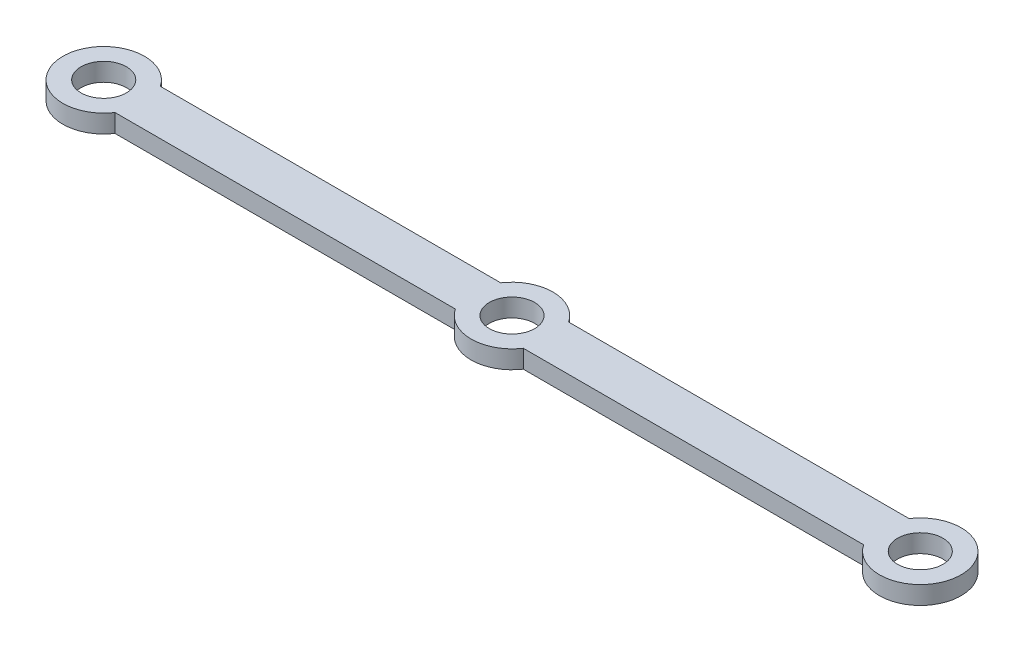
from build123d import *

# Parameters (mm, degrees)
SKETCH2_R           = 2.5
BOSS_EXTRUDE1_DEPTH = 2


with BuildPart() as part:
    # Sketch2 → Boss-Extrude1 (new body)
    with BuildSketch(Plane(origin=(0, 0, 0), x_dir=(1, 0, 0), z_dir=(0, 1, 0))):
        with BuildLine():
            ThreePointArc((3.741657387, 2.5), (-4.5, 0), (3.741657387, -2.5))
            Line((3.741657387, -2.5), (41.258342613, -2.5))
            ThreePointArc((41.258342613, -2.5), (45, -4.5), (48.741657387, -2.5))
            Line((48.741657387, -2.5), (86.258342613, -2.5))
            ThreePointArc((86.258342613, -2.5), (94.5, 0), (86.258342613, 2.5))
            Line((86.258342613, 2.5), (48.741657387, 2.5))
            ThreePointArc((48.741657387, 2.5), (45, 4.5), (41.258342613, 2.5))
            Line((41.258342613, 2.5), (3.741657387, 2.5))
        make_face()
        with Locations(Location((45, 0, 0), (0, 0, 270))):
            Circle(SKETCH2_R, mode=Mode.SUBTRACT)
        with Locations(Location((0, 0, 0), (0, 0, 270))):
            Circle(SKETCH2_R, mode=Mode.SUBTRACT)
        with Locations(Location((90, 0, 0), (0, 0, 270))):
            Circle(SKETCH2_R, mode=Mode.SUBTRACT)
    extrude(amount=BOSS_EXTRUDE1_DEPTH)


solid = part.part
